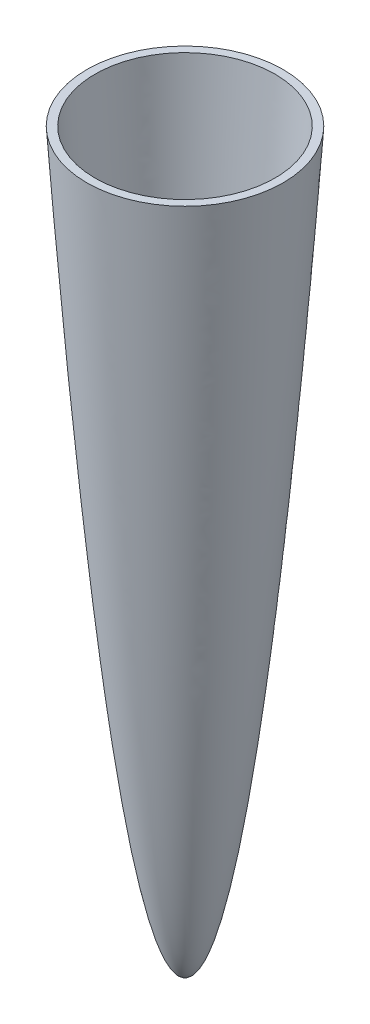
from build123d import *


with BuildPart() as part:
    # Sketch4 → Revolve2 (revolve)
    with BuildSketch(Plane(origin=(0, 0, 0), x_dir=(0, 0, -1), z_dir=(1, 0, 0)), mode=Mode.PRIVATE) as revolve2_sk:
        with BuildLine():
            Line((-10.16, 76.2), (-9.320087423, 76.204312562))
            add(Edge.make_bspline(
                [(0, 1), (-0.043182477, 0.999894151), (-0.100382547, 1.005746576), (-0.172604796, 1.023810771), (-0.262407907, 1.061631811), (-0.332378611, 1.099761705), (-0.412539248, 1.154576642), (-0.506623383, 1.23410446), (-0.618801294, 1.349300674), (-0.760552223, 1.527470646), (-0.949272976, 1.818373032), (-1.218630169, 2.340889719), (-1.621884256, 3.348571136), (-2.23594029, 5.416947816), (-2.975004634, 8.842712329), (-3.749288777, 13.523039805), (-4.508672166, 19.137588845), (-5.205327126, 25.147246955), (-5.823060924, 31.110576225), (-6.391931758, 37.164825466), (-6.909866933, 43.084476291), (-7.409001151, 49.233137067), (-7.85666255, 55.012551067), (-8.32065586, 61.405251541), (-8.69972768, 66.788780503), (-9.051694951, 72.076873718), (-9.231874731, 74.835591088), (-9.320087423, 76.204312562)],
                knots=[0, 0, 0, 0, 0, 0.002044781, 0.002744219, 0.003527702, 0.004640007, 0.00583916, 0.007369116, 0.009393453, 0.012301631, 0.016675206, 0.023900044, 0.037363829, 0.064064944, 0.119351696, 0.191238893, 0.263126095, 0.335013298, 0.406900501, 0.478787704, 0.550674907, 0.62256211, 0.694449313, 0.766336516, 0.838223719, 0.910110922, 0.910110922, 0.910110922, 0.910110922, 0.910110922], degree=4))
            Line((0, 1), (0, 0))
            add(Edge.make_bspline(
                [(0, 0), (-0.049409062, 9.0353e-05), (-0.113776475, 0.006304923), (-0.195438378, 0.024818992), (-0.29902372, 0.064240863), (-0.380764738, 0.104559629), (-0.476214071, 0.164164019), (-0.588422444, 0.251410524), (-0.720038284, 0.376526852), (-0.883511494, 0.566581743), (-1.095728657, 0.869307696), (-1.387591167, 1.388849257), (-1.80995045, 2.347372099), (-2.436765202, 4.228440344), (-3.239495872, 7.502656847), (-4.085767603, 12.072123297), (-4.923067432, 17.677034031), (-5.699503305, 23.820453496), (-6.384538875, 29.958441272), (-7.006010646, 36.12837274), (-7.575112766, 42.262080562), (-8.109347524, 48.468974871), (-8.541063252, 53.79023258), (-8.906053465, 58.531058978), (-9.181521749, 62.202791715), (-9.427992843, 65.615940516), (-9.6600692, 68.840186339), (-9.927737352, 72.747304031), (-10.066358977, 74.795384657), (-10.16, 76.2)],
                knots=[0, 0, 0, 0, 0, 0.002306944, 0.003038811, 0.003911988, 0.005198572, 0.006580923, 0.008315578, 0.010577102, 0.013715633, 0.018335303, 0.025658133, 0.038517111, 0.062864285, 0.111320796, 0.183957929, 0.256595081, 0.329232231, 0.401869381, 0.474506532, 0.547143683, 0.619780834, 0.692417985, 0.72873656, 0.765055136, 0.801373712, 0.837692287, 0.910329438, 0.910329438, 0.910329438, 0.910329438, 0.910329438], degree=4))
        make_face()
    revolve(revolve2_sk.sketch.rotate(Axis((0, 0, 0), (0, 1, 0)), 180), axis=Axis((0, 0, 0), (0, 1, 0)))


solid = part.part
